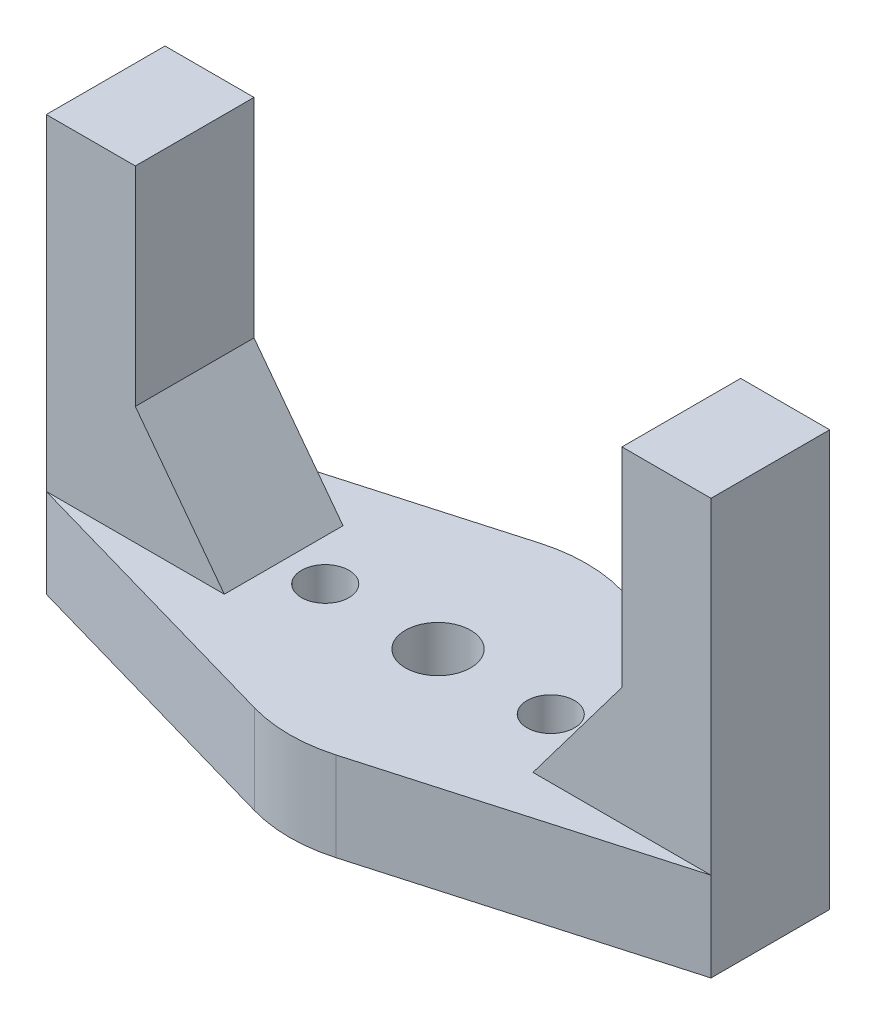
from build123d import *

# Parameters (mm, degrees)
SKETCH1_R               = 25
SKETCH1_R_2             = 1.8
SKETCH1_R_3             = 5.5
BOSS_EXTRUDE1_DEPTH     = 15
SKETCH2_R               = 4
CUT_EXTRUDE1_DEPTH      = 8
SKETCH3_W               = 82
SKETCH3_H               = 50
SKETCH3_R               = 24.5
BOSS_EXTRUDE2_DEPTH     = 15
SKETCH4_W               = 15
SKETCH4_H               = 20
BOSS_EXTRUDE3_DEPTH     = 70
CUT_EXTRUDE2_DEPTH      = 94.064493766
CUT_EXTRUDE2_DEPTH_BACK = 94.064493766
BOSS_EXTRUDE4_DEPTH     = 15
CHAMFER1_SIZE           = 15
CHAMFER1_SIZE2          = 19.905672324


with BuildPart() as part:
    # Sketch1 → Boss-Extrude1 (new body)
    with BuildSketch(Plane(origin=(0, 0, 0), x_dir=(1, 0, 0), z_dir=(0, 1, 0))):
        with Locations(Location((0, 0, 0), (0, 0, 270))):
            Circle(SKETCH1_R)
        with Locations(Location((-19, 0, 0), (0, 0, 270))):
            Circle(SKETCH1_R_2, mode=Mode.SUBTRACT)
        with Locations(Location((19, 0, 0), (0, 0, 90))):
            Circle(SKETCH1_R_2, mode=Mode.SUBTRACT)
        with Locations(Location((0, 0, 0), (0, 0, 270))):
            Circle(SKETCH1_R_3, mode=Mode.SUBTRACT)
    extrude(amount=BOSS_EXTRUDE1_DEPTH)

    # Sketch2 → Cut-Extrude1 (cut)
    with BuildSketch(Plane(origin=(0, 15, 0), x_dir=(1, 0, 0), z_dir=(0, 1, 0))):
        with Locations(Location((-19, 0, 0), (0, 0, 270))):
            Circle(SKETCH2_R)
        with Locations(Location((19, 0, 0), (0, 0, 270))):
            Circle(SKETCH2_R)
    extrude(amount=-CUT_EXTRUDE1_DEPTH, mode=Mode.SUBTRACT)

    # Sketch3 → Boss-Extrude2 (add)
    with BuildSketch(Plane.XZ):
        Rectangle(SKETCH3_W, SKETCH3_H)
        Circle(SKETCH3_R, mode=Mode.SUBTRACT)
    extrude(amount=-BOSS_EXTRUDE2_DEPTH)

    # Sketch4 → Boss-Extrude3 (add)
    with BuildSketch(Plane.XZ):
        with Locations((-48.5, 0)):
            Rectangle(SKETCH4_W, SKETCH4_H)
        with Locations((48.5, 0)):
            Rectangle(SKETCH4_W, SKETCH4_H)
    extrude(amount=-BOSS_EXTRUDE3_DEPTH)

    # Sketch5 → Cut-Extrude2 (cut, two sides: drawn at the far end of the back side and taken through both)
    with BuildSketch(Plane.XZ.offset(-CUT_EXTRUDE2_DEPTH_BACK)):
        Polygon((-41, -25), (-41, -14.285834105), (-56, -10), (-56, -25), align=None)
        with BuildLine():
            ThreePointArc((-2.6e-08, -25), (-3.467621731, -24.758344039), (-6.86820572, -24.03804797))
            Line((-6.86820572, -24.03804797), (-41, -14.285834105))
            Line((-41, -14.285834105), (-41, -25))
            Line((-41, -25), (-2.6e-08, -25))
        make_face()
        Polygon((-56, 25), (-56, 10), (-41, 14.285834105), (-41, 25), align=None)
        with BuildLine():
            Line((-41, 25), (-41, 14.285834105))
            Line((-41, 14.285834105), (-6.86820572, 24.03804797))
            ThreePointArc((-6.86820572, 24.03804797), (-3.467621732, 24.758344038), (-2.8e-08, 25))
            Line((-2.8e-08, 25), (-41, 25))
        make_face()
        with BuildLine():
            Line((41, 25), (-2.8e-08, 25))
            ThreePointArc((-2.8e-08, 25), (3.467621704, 24.758344042), (6.86820572, 24.03804797))
            Line((6.86820572, 24.03804797), (41, 14.285834105))
            Line((41, 14.285834105), (41, 25))
        make_face()
        with BuildLine():
            ThreePointArc((6.86820572, -24.03804797), (3.467621705, -24.758344042), (-2.6e-08, -25))
            Line((-2.6e-08, -25), (41, -25))
            Line((41, -25), (41, -14.285834105))
            Line((41, -14.285834105), (6.86820572, -24.03804797))
        make_face()
        Polygon((41, -14.285834105), (41, -25), (56, -25), (56, -10), align=None)
        Polygon((56, 25), (41, 25), (41, 14.285834105), (56, 10), align=None)
    extrude(amount=CUT_EXTRUDE2_DEPTH + CUT_EXTRUDE2_DEPTH_BACK, mode=Mode.SUBTRACT)

    # Sketch6 → Boss-Extrude4 (add)
    with BuildSketch(Plane.XZ):
        Polygon((-56, 10), (-41, 14.285834105), (-41, -14.285834105), (-56, -10), align=None)
        Polygon((41, 14.285834105), (56, 10), (56, -10), (41, -14.285834105), align=None)
    extrude(amount=-BOSS_EXTRUDE4_DEPTH)

    # Chamfer1
    chamfer1_edges = [part.edges().sort_by_distance(p)[0] for p in [
        (-41, 15, 0),
        (41, 15, 0),
    ]]
    chamfer1_side = [part.faces().sort_by_distance(p)[0] for p in [
        (0, 15, 23.773460151),
    ]]
    chamfer(chamfer1_edges, length=CHAMFER1_SIZE, length2=CHAMFER1_SIZE2, reference=chamfer1_side[0])


solid = part.part
